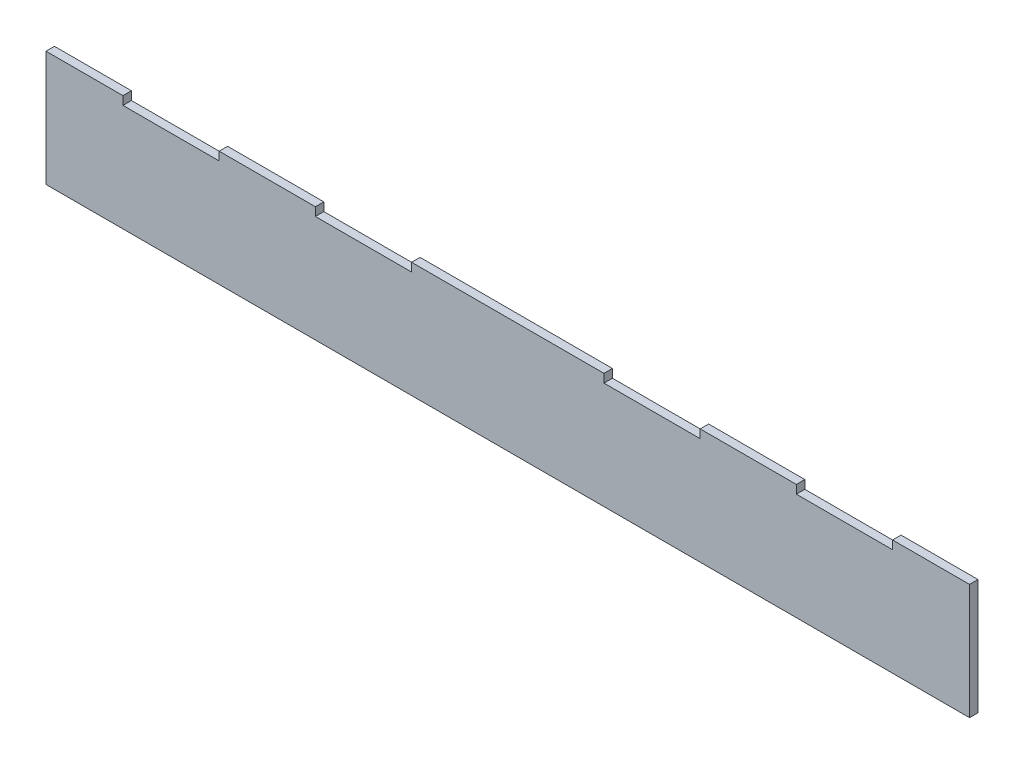
from build123d import *

# Parameters (mm, degrees)
BOSS_EXTRUDE1_DEPTH = 5.588


with BuildPart() as part:
    # Sketch1 → Boss-Extrude1 (new body)
    with BuildSketch(Plane.XY):
        Polygon((-801.771802918, 35.909761597), (-750.971802918, 35.909761597), (-750.971802918, 30.321761597), (-687.471802918, 30.321761597), (-687.471802918, 35.909761597), (-623.971802918, 35.909761597), (-623.971802918, 30.321761597), (-560.471802918, 30.321761597), (-560.471802918, 35.909761597), (-433.471802918, 35.909761597), (-433.471802918, 30.321761597), (-369.971802918, 30.321761597), (-369.971802918, 35.909761597), (-306.471802918, 35.909761597), (-306.471802918, 30.321761597), (-242.971802918, 30.321761597), (-242.971802918, 35.909761597), (-192.171802918, 35.909761597), (-192.171802918, -40.290238403), (-801.771802918, -40.290238403), align=None)
    extrude(amount=BOSS_EXTRUDE1_DEPTH)


solid = part.part
